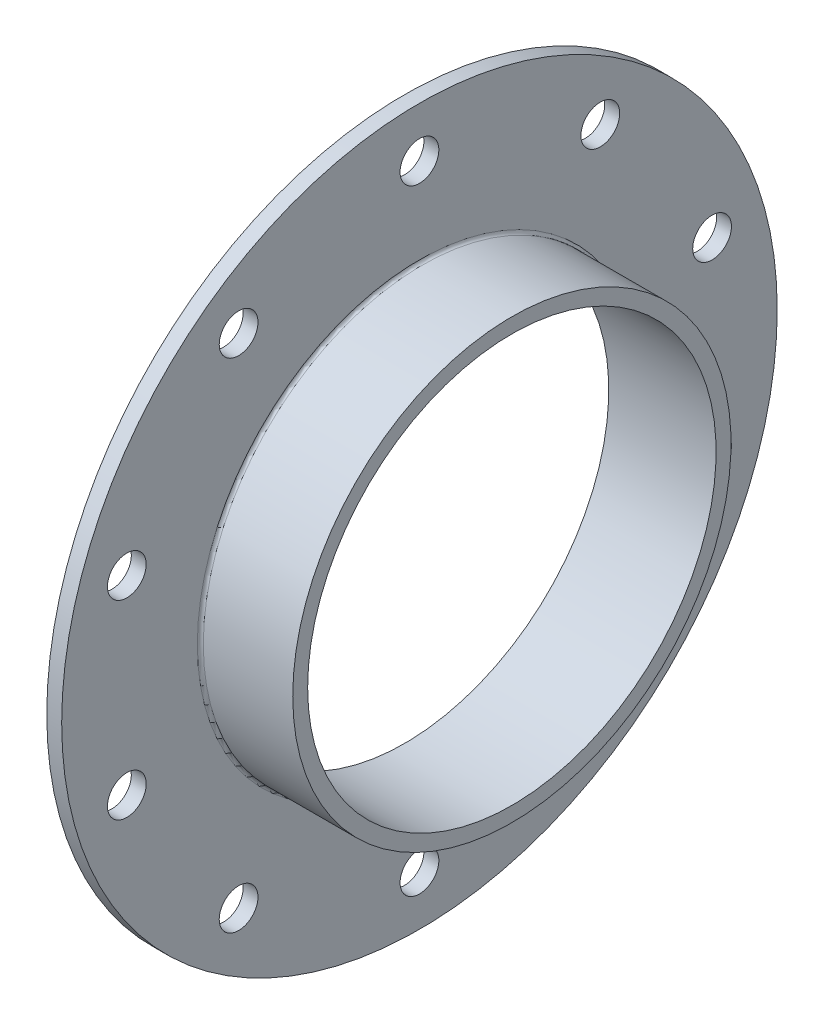
from build123d import *

# Parameters (mm, degrees)
SKETCH4_R          = 3.25
CUT_EXTRUDE1_DEPTH = 10
FILLET2_R          = 0.5


with BuildPart() as part:
    # Sketch3 → Revolve1 (revolve)
    with BuildSketch(Plane.XY, mode=Mode.PRIVATE) as revolve1_sk:
        Polygon((0, 34.25), (0, 60), (2.5, 60), (2.5, 36.75), (18, 36.75), (18, 34.25), align=None)
    revolve(revolve1_sk.sketch.rotate(Axis((0, 0, 0), (1, 0, 0)), 90), axis=Axis((0, 0, 0), (1, 0, 0)))

    # Sketch4 → Cut-Extrude1 (cut)
    with BuildSketch(Plane.ZY):
        with Locations((30.329719018, 41.74527691)):
            Circle(SKETCH4_R)
        with Locations((0, 51.6)):
            Circle(SKETCH4_R)
        with Locations((49.074516241, 15.94527691)):
            Circle(SKETCH4_R)
        with Locations((49.074516241, -15.94527691)):
            Circle(SKETCH4_R)
        with Locations((30.329719018, -41.74527691)):
            Circle(SKETCH4_R)
        with Locations((0, -51.6)):
            Circle(SKETCH4_R)
        with Locations((-30.329719018, -41.74527691)):
            Circle(SKETCH4_R)
        with Locations((-49.074516241, -15.94527691)):
            Circle(SKETCH4_R)
        with Locations((-49.074516241, 15.94527691)):
            Circle(SKETCH4_R)
        with Locations((-30.329719018, 41.74527691)):
            Circle(SKETCH4_R)
    extrude(amount=-CUT_EXTRUDE1_DEPTH, mode=Mode.SUBTRACT)

    # Fillet2
    fillet2_edges = [part.edges().sort_by_distance(p)[0] for p in [
        (2.5, 0, -36.75),
    ]]
    fillet(fillet2_edges, radius=FILLET2_R)


solid = part.part
